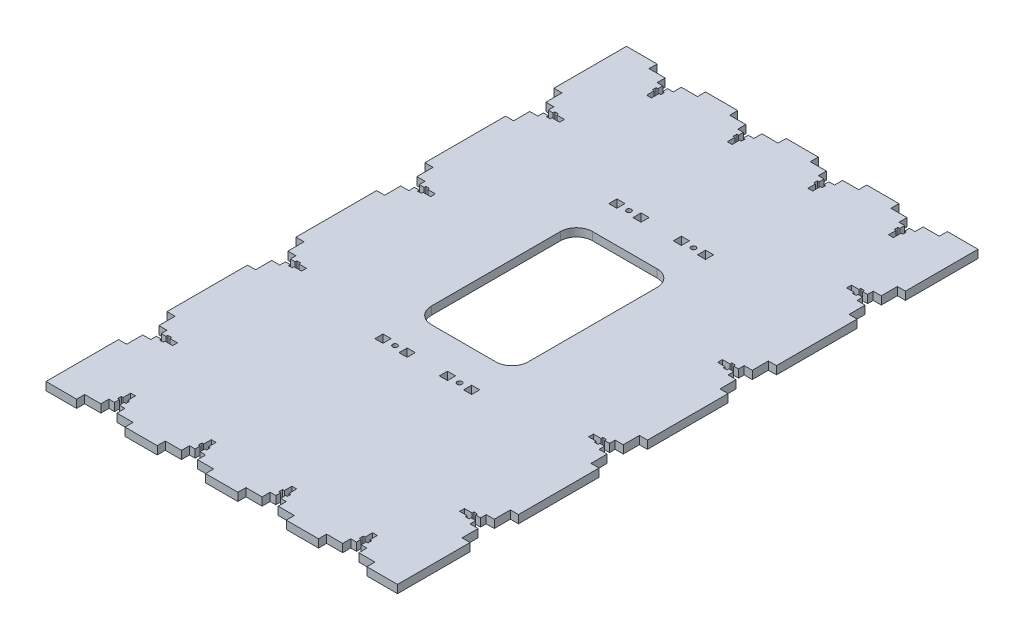
from build123d import *

# Parameters (mm, degrees)
SKETCH1_R           = 1.5
SKETCH1_W           = 5
SKETCH1_H           = 5.05
BOSS_EXTRUDE1_DEPTH = 5


with BuildPart() as part:
    # Sketch1 → Boss-Extrude1 (new body)
    with BuildSketch(Plane(origin=(0, 0, 0), x_dir=(1, 0, 0), z_dir=(0, 1, 0))):
        Polygon((109, 180), (90, 180), (90, 175), (80, 175), (80, 170), (76.5, 170), (76.5, 167), (77.6, 167), (77.6, 164.7), (76.5, 164.7), (76.5, 160), (73.5, 160), (73.5, 164.7), (72.4, 164.7), (72.4, 167), (73.5, 167), (73.5, 170), (70, 170), (70, 175), (60, 175), (60, 180), (40, 180), (40, 175), (30, 175), (30, 170), (26.5, 170), (26.5, 167), (27.6, 167), (27.6, 164.7), (26.5, 164.7), (26.5, 160), (23.5, 160), (23.5, 164.7), (22.4, 164.7), (22.4, 167), (23.5, 167), (23.5, 170), (20, 170), (20, 175), (10, 175), (10, 180), (-10, 180), (-10, 175), (-20, 175), (-20, 170), (-23.5, 170), (-23.5, 167), (-22.4, 167), (-22.4, 164.7), (-23.5, 164.7), (-23.5, 160), (-26.5, 160), (-26.5, 164.7), (-27.6, 164.7), (-27.6, 167), (-26.5, 167), (-26.5, 170), (-30, 170), (-30, 175), (-40, 175), (-40, 180), (-60, 180), (-60, 175), (-70, 175), (-70, 170), (-73.5, 170), (-73.5, 167), (-72.4, 167), (-72.4, 164.7), (-73.5, 164.7), (-73.5, 160), (-76.5, 160), (-76.5, 164.7), (-77.6, 164.7), (-77.6, 167), (-76.5, 167), (-76.5, 170), (-80, 170), (-80, 175), (-90, 175), (-90, 180), (-109, 180), (-109, 135), (-104, 135), (-104, 125), (-99, 125), (-99, 121.5), (-96, 121.5), (-96, 122.6), (-93.7, 122.6), (-93.7, 121.5), (-89, 121.5), (-89, 118.5), (-93.7, 118.5), (-93.7, 117.4), (-96, 117.4), (-96, 118.5), (-99, 118.5), (-99, 115), (-104, 115), (-104, 105), (-109, 105), (-109, 55), (-104, 55), (-104, 45), (-99, 45), (-99, 41.5), (-96, 41.5), (-96, 42.6), (-93.7, 42.6), (-93.7, 41.5), (-89, 41.5), (-89, 38.5), (-93.7, 38.5), (-93.7, 37.4), (-96, 37.4), (-96, 38.5), (-99, 38.5), (-99, 35), (-104, 35), (-104, 25), (-109, 25), (-109, -25), (-104, -25), (-104, -35), (-99, -35), (-99, -38.5), (-96, -38.5), (-96, -37.4), (-93.7, -37.4), (-93.7, -38.5), (-89, -38.5), (-89, -41.5), (-93.7, -41.5), (-93.7, -42.6), (-96, -42.6), (-96, -41.5), (-99, -41.5), (-99, -45), (-104, -45), (-104, -55), (-109, -55), (-109, -105), (-104, -105), (-104, -115), (-99, -115), (-99, -118.5), (-96, -118.5), (-96, -117.4), (-93.7, -117.4), (-93.7, -118.5), (-89, -118.5), (-89, -121.5), (-93.7, -121.5), (-93.7, -122.6), (-96, -122.6), (-96, -121.5), (-99, -121.5), (-99, -125), (-104, -125), (-104, -135), (-109, -135), (-109, -180), (-90, -180), (-90, -175), (-80, -175), (-80, -170), (-76.5, -170), (-76.5, -167), (-77.6, -167), (-77.6, -164.7), (-76.5, -164.7), (-76.5, -160), (-73.5, -160), (-73.5, -164.7), (-72.4, -164.7), (-72.4, -167), (-73.5, -167), (-73.5, -170), (-70, -170), (-70, -175), (-60, -175), (-60, -180), (-40, -180), (-40, -175), (-30, -175), (-30, -170), (-26.5, -170), (-26.5, -167), (-27.6, -167), (-27.6, -164.7), (-26.5, -164.7), (-26.5, -160), (-23.5, -160), (-23.5, -164.7), (-22.4, -164.7), (-22.4, -167), (-23.5, -167), (-23.5, -170), (-20, -170), (-20, -175), (-10, -175), (-10, -180), (10, -180), (10, -175), (20, -175), (20, -170), (23.5, -170), (23.5, -167), (22.4, -167), (22.4, -164.7), (23.5, -164.7), (23.5, -160), (26.5, -160), (26.5, -164.7), (27.6, -164.7), (27.6, -167), (26.5, -167), (26.5, -170), (30, -170), (30, -175), (40, -175), (40, -180), (60, -180), (60, -175), (70, -175), (70, -170), (73.5, -170), (73.5, -167), (72.4, -167), (72.4, -164.7), (73.5, -164.7), (73.5, -160), (76.5, -160), (76.5, -164.7), (77.6, -164.7), (77.6, -167), (76.5, -167), (76.5, -170), (80, -170), (80, -175), (90, -175), (90, -180), (109, -180), (109, -135), (104, -135), (104, -125), (99, -125), (99, -121.5), (96, -121.5), (96, -122.6), (93.7, -122.6), (93.7, -121.5), (89, -121.5), (89, -118.5), (93.7, -118.5), (93.7, -117.4), (96, -117.4), (96, -118.5), (99, -118.5), (99, -115), (104, -115), (104, -105), (109, -105), (109, -55), (104, -55), (104, -45), (99, -45), (99, -41.5), (96, -41.5), (96, -42.6), (93.7, -42.6), (93.7, -41.5), (89, -41.5), (89, -38.5), (93.7, -38.5), (93.7, -37.4), (96, -37.4), (96, -38.5), (99, -38.5), (99, -35), (104, -35), (104, -25), (109, -25), (109, 25), (104, 25), (104, 35), (99, 35), (99, 38.5), (96, 38.5), (96, 37.4), (93.7, 37.4), (93.7, 38.5), (89, 38.5), (89, 41.5), (93.7, 41.5), (93.7, 42.6), (96, 42.6), (96, 41.5), (99, 41.5), (99, 45), (104, 45), (104, 55), (109, 55), (109, 105), (104, 105), (104, 115), (99, 115), (99, 118.5), (96, 118.5), (96, 117.4), (93.7, 117.4), (93.7, 118.5), (89, 118.5), (89, 121.5), (93.7, 121.5), (93.7, 122.6), (96, 122.6), (96, 121.5), (99, 121.5), (99, 125), (104, 125), (104, 135), (109, 135), align=None)
        with Locations(Location((20, 92.525, 0), (0, 0, 270))):
            Circle(SKETCH1_R, mode=Mode.SUBTRACT)
        with Locations(Location((-20, 92.525, 0), (0, 0, 270))):
            Circle(SKETCH1_R, mode=Mode.SUBTRACT)
        with Locations(Location((-20, -52.525, 0), (0, 0, 270))):
            Circle(SKETCH1_R, mode=Mode.SUBTRACT)
        with Locations(Location((20, -52.525, 0), (0, 0, 270))):
            Circle(SKETCH1_R, mode=Mode.SUBTRACT)
        with Locations((-12.5, 92.525)):
            Rectangle(SKETCH1_W, SKETCH1_H, mode=Mode.SUBTRACT)
        with BuildLine():
            Line((-20, 70), (20, 70))
            ThreePointArc((20, 70), (27.071067812, 67.071067812), (30, 60))
            Line((30, 60), (30, -20))
            ThreePointArc((30, -20), (27.071067812, -27.071067812), (20, -30))
            Line((20, -30), (-20, -30))
            ThreePointArc((-20, -30), (-27.071067812, -27.071067812), (-30, -20))
            Line((-30, -20), (-30, 60))
            ThreePointArc((-30, 60), (-27.071067812, 67.071067812), (-20, 70))
        make_face(mode=Mode.SUBTRACT)
        with Locations((27.5, 92.525)):
            Rectangle(SKETCH1_W, SKETCH1_H, mode=Mode.SUBTRACT)
        with Locations((12.5, 92.525)):
            Rectangle(SKETCH1_W, SKETCH1_H, mode=Mode.SUBTRACT)
        with Locations((-27.5, 92.525)):
            Rectangle(SKETCH1_W, SKETCH1_H, mode=Mode.SUBTRACT)
        with Locations((-12.5, -52.525)):
            Rectangle(SKETCH1_W, SKETCH1_H, mode=Mode.SUBTRACT)
        with Locations((-27.5, -52.525)):
            Rectangle(SKETCH1_W, SKETCH1_H, mode=Mode.SUBTRACT)
        with Locations((12.5, -52.525)):
            Rectangle(SKETCH1_W, SKETCH1_H, mode=Mode.SUBTRACT)
        with Locations((27.5, -52.525)):
            Rectangle(SKETCH1_W, SKETCH1_H, mode=Mode.SUBTRACT)
    extrude(amount=BOSS_EXTRUDE1_DEPTH)


solid = part.part
